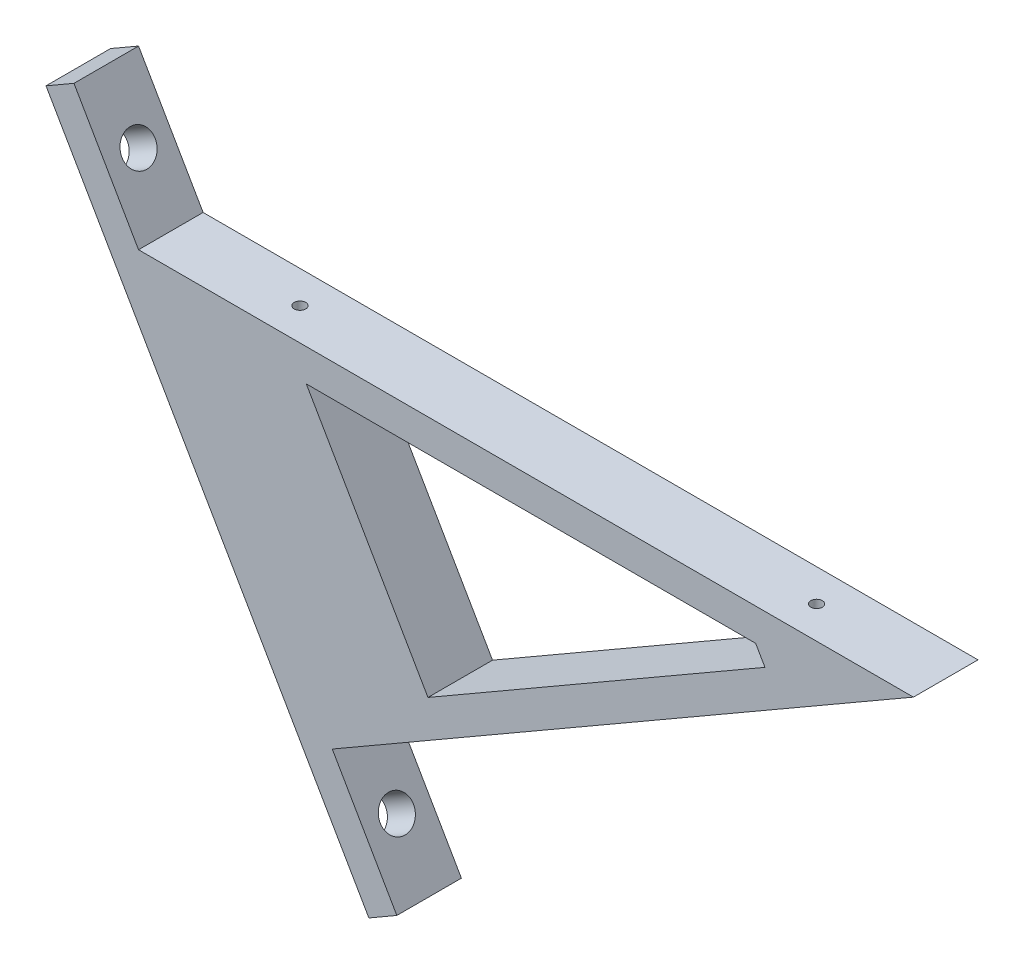
from build123d import *

# Parameters (mm, degrees)
BOSS_EXTRUDE1_DEPTH = 12.7
SKETCH2_R           = 1.1303
CUT_EXTRUDE1_DEPTH  = 10
SKETCH3_R           = 3.2639
CUT_EXTRUDE2_DEPTH  = 10


with BuildPart() as part:
    # Sketch1 → Boss-Extrude1 (new body)
    # profile 1 of 4: a face of its own
    with BuildSketch(Plane.XY):
        Polygon((-152.4, 0), (0, 0), (-114.3, -65.991135768), align=None)
        Polygon((-119.404432116, -6.35), (-31.030871047, -6.35), (-29.197783942, -9.525), (-95.477954744, -47.791874454), align=None, mode=Mode.SUBTRACT)
    # profile 2 of 4: a face of its own
    with BuildSketch(Plane.XY):
        Polygon((-165.1, 21.997045256), (-170.599261314, 18.822045256), (-157.899261314, -3.175), (-152.4, 0), align=None)
    # profile 3 of 4: a face of its own
    with BuildSketch(Plane.XY):
        Polygon((-157.899261314, -3.175), (-119.799261314, -69.166135768), (-114.3, -65.991135768), (-152.4, 0), align=None)
    # profile 4 of 4: a face of its own
    with BuildSketch(Plane.XY):
        Polygon((-107.099261314, -91.163181024), (-119.799261314, -69.166135768), (-114.3, -65.991135768), (-101.6, -87.988181024), align=None)
    extrude(amount=BOSS_EXTRUDE1_DEPTH)

    # Sketch2 → Cut-Extrude1 (cut)
    with BuildSketch(Plane(origin=(0, 0, 0), x_dir=(1, 0, 0), z_dir=(0, 1, 0))):
        with Locations(Location((-127, -6.35, 0), (0, 0, 180))):
            Circle(SKETCH2_R)
        with Locations(Location((-25.4, -6.35, 0), (0, 0, 180))):
            Circle(SKETCH2_R)
    extrude(amount=-CUT_EXTRUDE1_DEPTH, mode=Mode.SUBTRACT)

    # Sketch3 → Cut-Extrude2 (cut)
    with BuildSketch(Plane(origin=(-114.3, -65.991135768, 0), x_dir=(0, 0, -1), z_dir=(0.8660254037844342, 0.5000000000000079, 0))):
        with Locations(Location((-6.35, 88.9, 0), (0, 0, 90))):
            Circle(SKETCH3_R)
        with Locations(Location((-6.35, -12.7, 0), (0, 0, 90))):
            Circle(SKETCH3_R)
    extrude(amount=-CUT_EXTRUDE2_DEPTH, mode=Mode.SUBTRACT)


solid = part.part
